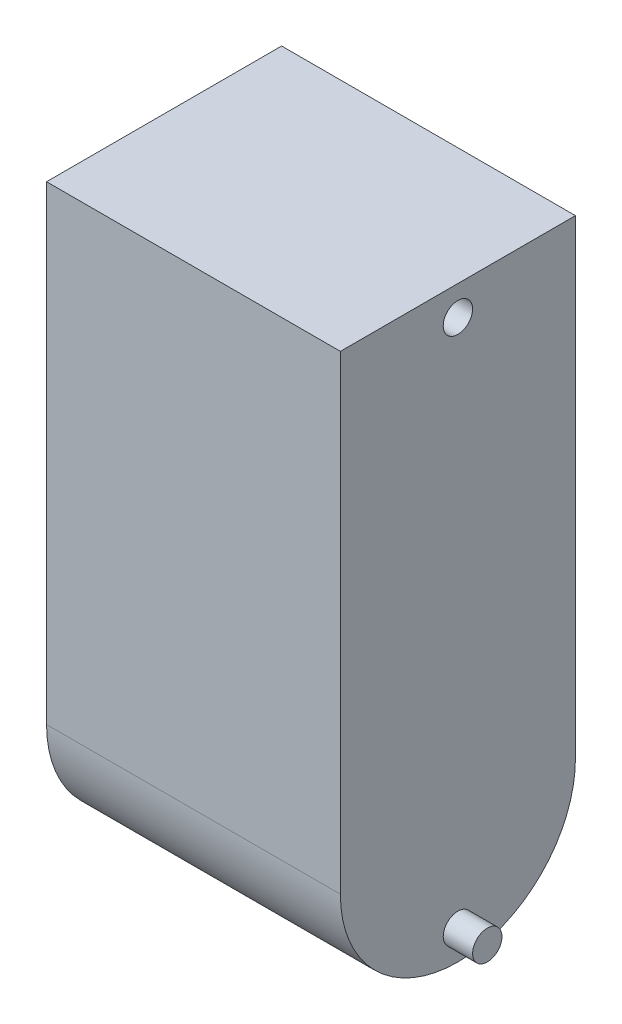
from build123d import *

# Parameters (mm, degrees)
SKETCH1_W                = 254
SKETCH1_H                = 508
BOSS_EXTRUDE1_DEPTH      = 203.2
FILLET1_RADIUS           = 101.6
FILLET1_LENGTH           = 254
BOSS_EXTRUDE2_DEPTH      = 25.4
BOSS_EXTRUDE2_DEPTH_BACK = 279.4
SKETCH2_R                = 12.7
CUT_EXTRUDE1_DEPTH       = 195.834
CUT_EXTRUDE1_DEPTH_BACK  = 440.182
SKETCH4_R                = 12.7


with BuildPart() as part:
    # Sketch1 → Boss-Extrude1 (new body)
    with BuildSketch(Plane.XY):
        with Locations((127, 254)):
            Rectangle(SKETCH1_W, SKETCH1_H)
    extrude(amount=BOSS_EXTRUDE1_DEPTH)

    # Fillet1: full round fillet: the end face becomes a half cylinder, R = half its width
    fillet1_face = Plane((127, 0, 101.6), x_dir=(1, 0, 0), z_dir=(0, -1, 0))  # on the end face: x along it, z out of the body
    fillet1_slab = fillet1_face.offset(-FILLET1_RADIUS / 2) * Box(FILLET1_LENGTH, 2 * FILLET1_RADIUS, FILLET1_RADIUS, mode=Mode.PRIVATE)  # the body's end, R deep
    fillet1_round = Plane((127, 101.6, 101.6), x_dir=(0, -1, 0), z_dir=(1, 0, 0)) * Cylinder(FILLET1_RADIUS, FILLET1_LENGTH, mode=Mode.PRIVATE)  # its axis R under the face
    add(fillet1_slab - fillet1_round, mode=Mode.SUBTRACT)

    # Sketch2 → Boss-Extrude2 (add, two sides: drawn at the far end of the back side and taken through both)
    with BuildSketch(Plane(origin=(254, 0, 0), x_dir=(0, 0, -1), z_dir=(1, 0, 0)).offset(-BOSS_EXTRUDE2_DEPTH_BACK)):
        with Locations((-101.6, 25.4)):
            Circle(SKETCH2_R)
    extrude(amount=BOSS_EXTRUDE2_DEPTH + BOSS_EXTRUDE2_DEPTH_BACK)

    # Sketch4 → Cut-Extrude1 (cut, two sides: drawn at the far end of the back side and taken through both)
    with BuildSketch(Plane(origin=(254, 0, 0), x_dir=(0, 0, -1), z_dir=(1, 0, 0)).offset(-CUT_EXTRUDE1_DEPTH_BACK)):
        with Locations(Location((-101.6, 482.6, 0), (0, 0, 180))):
            Circle(SKETCH4_R)
    extrude(amount=CUT_EXTRUDE1_DEPTH + CUT_EXTRUDE1_DEPTH_BACK, mode=Mode.SUBTRACT)


solid = part.part
